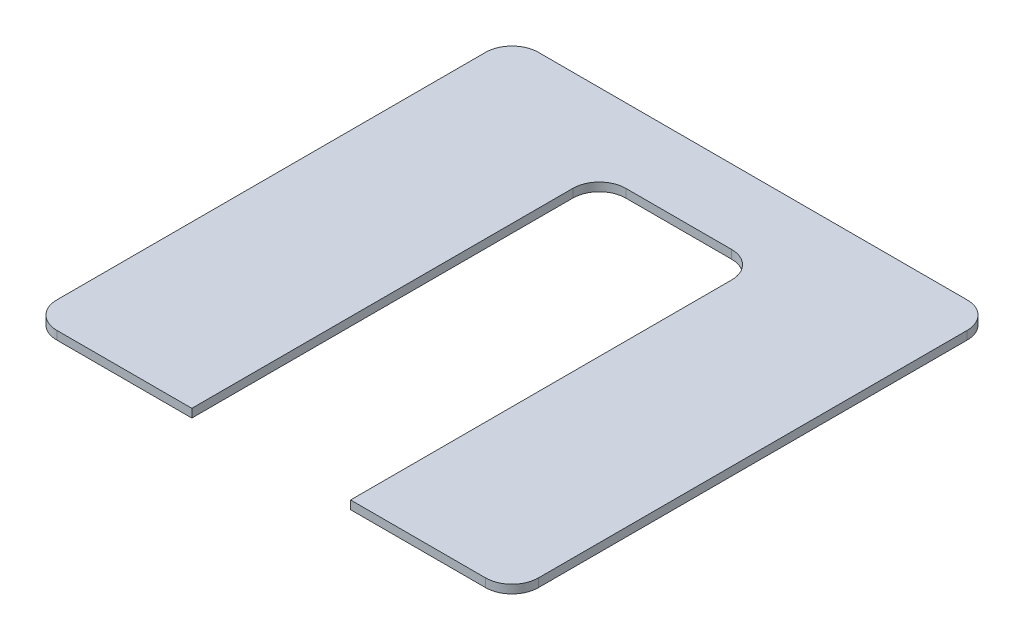
from build123d import *

# Parameters (mm, degrees)
SKETCH1_W           = 91
SKETCH1_H           = 91
BOSS_EXTRUDE1_DEPTH = 1.6
SKETCH2_W           = 30
SKETCH2_H           = 77
CUT_EXTRUDE1_DEPTH  = 65.366606249
FILLET1_R           = 5


with BuildPart() as part:
    # Sketch1 → Boss-Extrude1 (new body)
    with BuildSketch(Plane(origin=(0, 0, 0), x_dir=(1, 0, 0), z_dir=(0, 1, 0))):
        Rectangle(SKETCH1_W, SKETCH1_H)
    extrude(amount=BOSS_EXTRUDE1_DEPTH)

    # Sketch2 → Cut-Extrude1 (cut, through all)
    with BuildSketch(Plane(origin=(0, 1.6, 0), x_dir=(1, 0, 0), z_dir=(0, 1, 0))):
        with Locations((0, -7)):
            Rectangle(SKETCH2_W, SKETCH2_H)
    extrude(amount=-CUT_EXTRUDE1_DEPTH, mode=Mode.SUBTRACT)

    # Fillet1
    fillet1_edges = [part.edges().sort_by_distance(p)[0] for p in [
        (15, 0.8, -31.5),
        (-15, 0.8, -31.5),
        (-45.5, 0.8, 45.5),
        (45.5, 0.8, 45.5),
        (45.5, 0.8, -45.5),
        (-45.5, 0.8, -45.5),
    ]]
    fillet(fillet1_edges, radius=FILLET1_R)


solid = part.part
